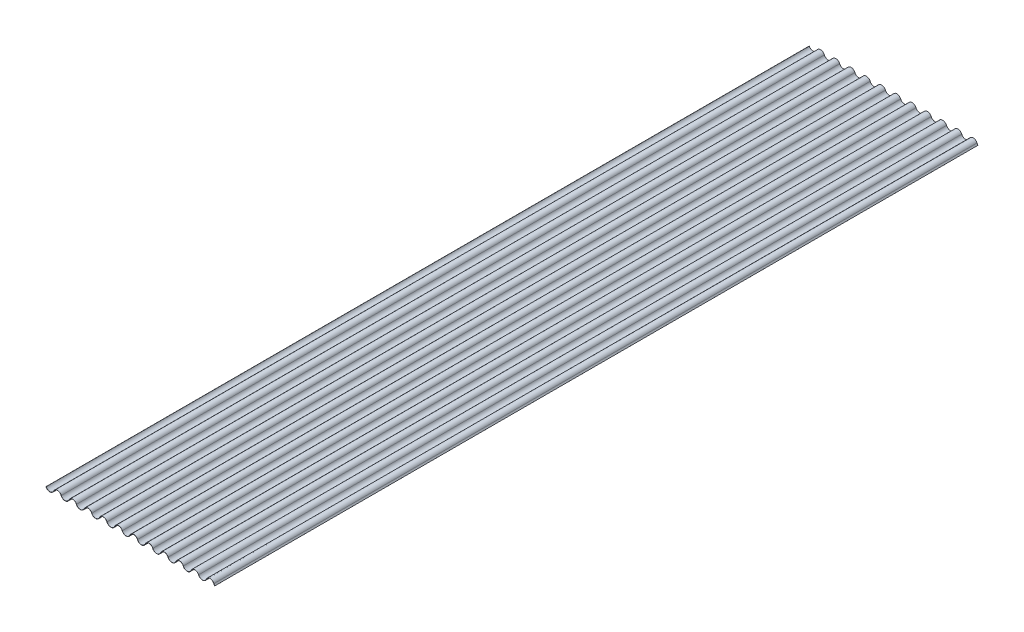
from build123d import *

# Parameters (mm, degrees)
RESSALTO_EXTRUS_O1_DEPTH = 5000


with BuildPart() as part:
    # Esboço1 → Ressalto-extrusão1 (new body)
    with BuildSketch(Plane.XY):
        with BuildLine():
            Line((-1050, 0), (-1048.906264859, 0.539317413))
            ThreePointArc((-1048.906264859, 0.539317413), (-1024.628710002, -15.652028698), (-1000, 0))
            ThreePointArc((-1000, 0), (-975, 16.801960973), (-950, 0))
            ThreePointArc((-950, 0), (-925, -16.801960973), (-900, 0))
            ThreePointArc((-900, 0), (-875, 16.801960973), (-850, 0))
            ThreePointArc((-850, 0), (-825, -16.801960973), (-800, 0))
            ThreePointArc((-800, 0), (-775, 16.801960973), (-750, 0))
            ThreePointArc((-750, 0), (-725, -16.801960973), (-700, 0))
            ThreePointArc((-700, 0), (-675, 16.801960973), (-650, 0))
            ThreePointArc((-650, 0), (-625, -16.801960973), (-600, 0))
            ThreePointArc((-600, 0), (-575, 16.801960973), (-550, 0))
            ThreePointArc((-550, 0), (-525, -16.801960973), (-500, 0))
            ThreePointArc((-500, 0), (-475, 16.801960973), (-450, 0))
            ThreePointArc((-450, 0), (-425, -16.801960973), (-400, 0))
            ThreePointArc((-400, 0), (-375, 16.801960973), (-350, 0))
            ThreePointArc((-350, 0), (-325, -16.801960973), (-300, 0))
            ThreePointArc((-300, 0), (-275, 16.801960973), (-250, 0))
            ThreePointArc((-250, 0), (-225, -16.801960973), (-200, 0))
            ThreePointArc((-200, 0), (-175, 16.801960973), (-150, 0))
            ThreePointArc((-150, 0), (-125, -16.801960973), (-100, 0))
            ThreePointArc((-100, 0), (-75, 16.801960973), (-50, 0))
            ThreePointArc((-50, 0), (-25, -16.801960973), (0, 0))
            ThreePointArc((0, 0), (25, 16.801960973), (50, 0))
            ThreePointArc((50, 0), (52.741476306, -5.084569487), (56.501792696, -9.469607668))
            Line((56.501792696, -9.469607668), (55.816673907, -10.198039027))
            ThreePointArc((55.816673907, -10.198039027), (51.91708654, -5.650592024), (49.074074074, -0.377705149))
            ThreePointArc((49.074074074, -0.377705149), (25, 15.801960973), (0.925925926, -0.377705149))
            ThreePointArc((0.925925926, -0.377705149), (-25, -17.801960973), (-50.925925926, -0.377705149))
            ThreePointArc((-50.925925926, -0.377705149), (-75, 15.801960973), (-99.074074074, -0.377705149))
            ThreePointArc((-99.074074074, -0.377705149), (-125, -17.801960973), (-150.925925926, -0.377705149))
            ThreePointArc((-150.925925926, -0.377705149), (-175, 15.801960973), (-199.074074074, -0.377705149))
            ThreePointArc((-199.074074074, -0.377705149), (-225, -17.801960973), (-250.925925926, -0.377705149))
            ThreePointArc((-250.925925926, -0.377705149), (-275, 15.801960973), (-299.074074074, -0.377705149))
            ThreePointArc((-299.074074074, -0.377705149), (-325, -17.801960973), (-350.925925926, -0.377705149))
            ThreePointArc((-350.925925926, -0.377705149), (-375, 15.801960973), (-399.074074074, -0.377705149))
            ThreePointArc((-399.074074074, -0.377705149), (-425, -17.801960973), (-450.925925926, -0.377705149))
            ThreePointArc((-450.925925926, -0.377705149), (-475, 15.801960973), (-499.074074074, -0.377705149))
            ThreePointArc((-499.074074074, -0.377705149), (-525, -17.801960973), (-550.925925926, -0.377705149))
            ThreePointArc((-550.925925926, -0.377705149), (-575, 15.801960973), (-599.074074074, -0.377705149))
            ThreePointArc((-599.074074074, -0.377705149), (-625, -17.801960973), (-650.925925926, -0.377705149))
            ThreePointArc((-650.925925926, -0.377705149), (-675, 15.801960973), (-699.074074074, -0.377705149))
            ThreePointArc((-699.074074074, -0.377705149), (-725, -17.801960973), (-750.925925926, -0.377705149))
            ThreePointArc((-750.925925926, -0.377705149), (-775, 15.801960973), (-799.074074074, -0.377705149))
            ThreePointArc((-799.074074074, -0.377705149), (-825, -17.801960973), (-850.925925926, -0.377705149))
            ThreePointArc((-850.925925926, -0.377705149), (-875, 15.801960973), (-899.074074074, -0.377705149))
            ThreePointArc((-899.074074074, -0.377705149), (-925, -17.801960973), (-950.925925926, -0.377705149))
            ThreePointArc((-950.925925926, -0.377705149), (-975, 15.801960973), (-999.074074074, -0.377705149))
            ThreePointArc((-999.074074074, -0.377705149), (-1024.659813644, -16.74280323), (-1050, 0))
        make_face()
    extrude(amount=RESSALTO_EXTRUS_O1_DEPTH)


solid = part.part
